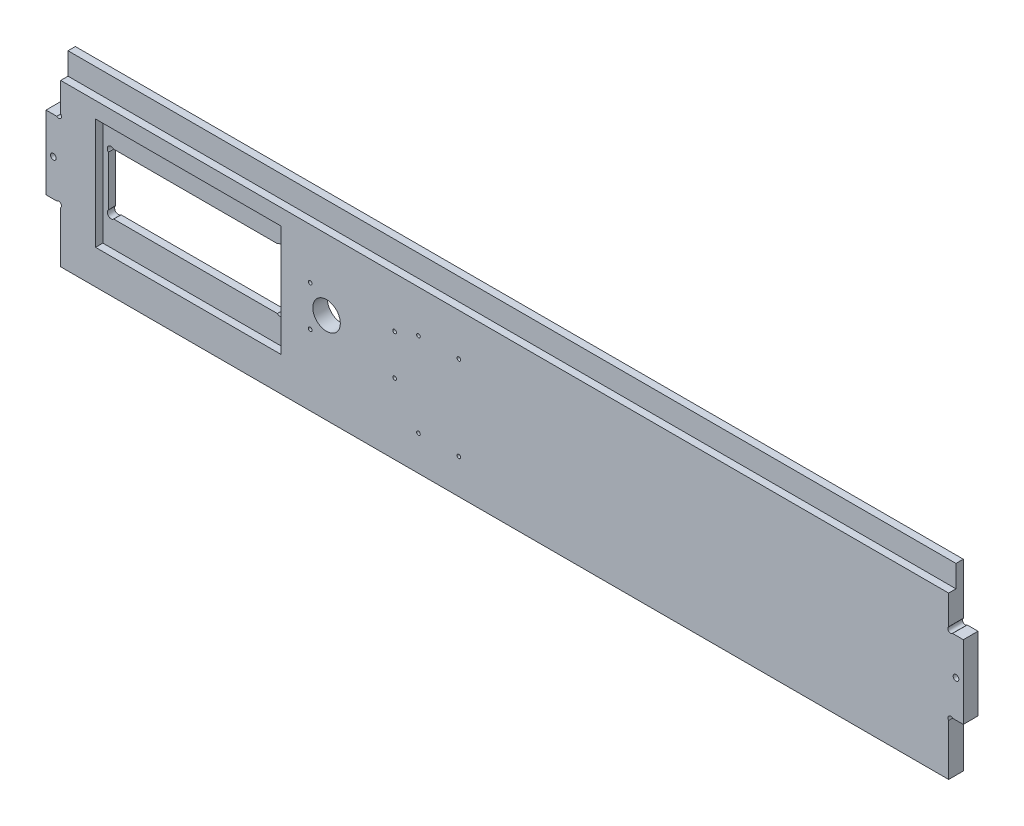
from build123d import *

# Parameters (mm, degrees)
ESQUISSE1_R             = 1.55
BOSS_EXTRU_1_DEPTH      = 8
ESQUISSE2_W             = 508.684044726
ESQUISSE2_H             = 12
ENL_V_MAT_EXTRU_1_DEPTH = 4
ESQUISSE3_R             = 7.5
ENL_V_MAT_EXTRU_2_DEPTH = 10
ESQUISSE4_W             = 101
ESQUISSE4_H             = 60.6
ENL_V_MAT_EXTRU_3_DEPTH = 4
ESQUISSE5_R             = 1
ENL_V_MAT_EXTRU_4_DEPTH = 4


with BuildPart() as part:
    # Esquisse1 → Boss.-Extru.1 (new body)
    with BuildSketch(Plane.XY):
        with BuildLine():
            Line((-399.388568491, 52.350857253), (-399.388568491, 24.472177597))
            ThreePointArc((-399.388568491, 24.472177597), (-399.388568491, 22.350857253), (-401.509888834, 22.350857253))
            Line((-401.509888834, 22.350857253), (-407.388568491, 22.350857253))
            Line((-407.388568491, 22.350857253), (-407.388568491, -17.649142747))
            Line((-407.388568491, -17.649142747), (-401.509888834, -17.649142747))
            ThreePointArc((-401.509888834, -17.649142747), (-399.388568491, -17.649142747), (-399.388568491, -19.77046309))
            Line((-399.388568491, -19.77046309), (-399.388568491, -47.649142747))
            Line((-399.388568491, -47.649142747), (84.611431509, -47.649142747))
            Line((84.611431509, -47.649142747), (84.611431509, -19.77046309))
            ThreePointArc((84.611431509, -19.77046309), (84.611431509, -17.649142747), (86.732751853, -17.649142747))
            Line((86.732751853, -17.649142747), (92.611431509, -17.649142747))
            Line((92.611431509, -17.649142747), (92.611431509, 22.350857253))
            Line((92.611431509, 22.350857253), (86.732751853, 22.350857253))
            ThreePointArc((86.732751853, 22.350857253), (84.611431509, 22.350857253), (84.611431509, 24.472177597))
            Line((84.611431509, 24.472177597), (84.611431509, 52.350857253))
            Line((84.611431509, 52.350857253), (-399.388568491, 52.350857253))
        make_face()
        with Locations((-403.388568491, 2.350857253)):
            Circle(ESQUISSE1_R, mode=Mode.SUBTRACT)
        with Locations(Location((88.611431509, 2.350857253, 0), (0, 0, 180))):
            Circle(ESQUISSE1_R, mode=Mode.SUBTRACT)
    extrude(amount=BOSS_EXTRU_1_DEPTH)

    # Esquisse2 → Enlèv. mat.-Extru.1 (cut)
    with BuildSketch(Plane.XY.offset(8)):
        with Locations((-159.986239331, 46.350857253)):
            Rectangle(ESQUISSE2_W, ESQUISSE2_H)
    extrude(amount=-ENL_V_MAT_EXTRU_1_DEPTH, mode=Mode.SUBTRACT)

    # Esquisse3 → Enlèv. mat.-Extru.2 (cut)
    with BuildSketch(Plane.XY.offset(8)):
        with Locations((-254.476180512, 1.850857253)):
            Circle(ESQUISSE3_R)
        with BuildLine():
            Line((-374.489430688, -14.649142747), (-285.287706293, -14.649142747))
            ThreePointArc((-285.287706293, -14.649142747), (-282.388568491, -14.649142747), (-282.388568491, -11.750004944))
            Line((-282.388568491, -11.750004944), (-282.388568491, 15.45171945))
            ThreePointArc((-282.388568491, 15.45171945), (-282.388568491, 18.350857253), (-285.287706293, 18.350857253))
            Line((-285.287706293, 18.350857253), (-374.489430688, 18.350857253))
            ThreePointArc((-374.489430688, 18.350857253), (-377.388568491, 18.350857253), (-377.388568491, 15.45171945))
            Line((-377.388568491, 15.45171945), (-377.388568491, -11.750004944))
            ThreePointArc((-377.388568491, -11.750004944), (-377.388568491, -14.649142747), (-374.489430688, -14.649142747))
        make_face()
    extrude(amount=-ENL_V_MAT_EXTRU_2_DEPTH, mode=Mode.SUBTRACT)

    # Esquisse4 → Enlèv. mat.-Extru.3 (cut)
    with BuildSketch(Plane.XY.offset(8)):
        with Locations((-329.888568491, 1.350857253)):
            Rectangle(ESQUISSE4_W, ESQUISSE4_H)
    extrude(amount=-ENL_V_MAT_EXTRU_3_DEPTH, mode=Mode.SUBTRACT)

    # Esquisse5 → Enlèv. mat.-Extru.4 (cut)
    with BuildSketch(Plane.XY.offset(8)):
        with Locations((-263.388568491, -9.149142747)):
            Circle(ESQUISSE5_R)
        with Locations(Location((-263.388568491, 12.850857253, 0), (0, 0, 180))):
            Circle(ESQUISSE5_R)
        with Locations((-217.388568491, 12.850857253)):
            Circle(ESQUISSE5_R)
        with Locations(Location((-217.388568491, -9.149142747, 0), (0, 0, 180))):
            Circle(ESQUISSE5_R)
        with Locations((-204.388008491, 17.350757253)):
            Circle(ESQUISSE5_R)
        with Locations((-182.389068491, 17.350757253)):
            Circle(ESQUISSE5_R)
        with Locations((-204.388008491, -28.648642747)):
            Circle(ESQUISSE5_R)
        with Locations((-182.389068491, -28.648642747)):
            Circle(ESQUISSE5_R)
    extrude(amount=-ENL_V_MAT_EXTRU_4_DEPTH, mode=Mode.SUBTRACT)


solid = part.part
